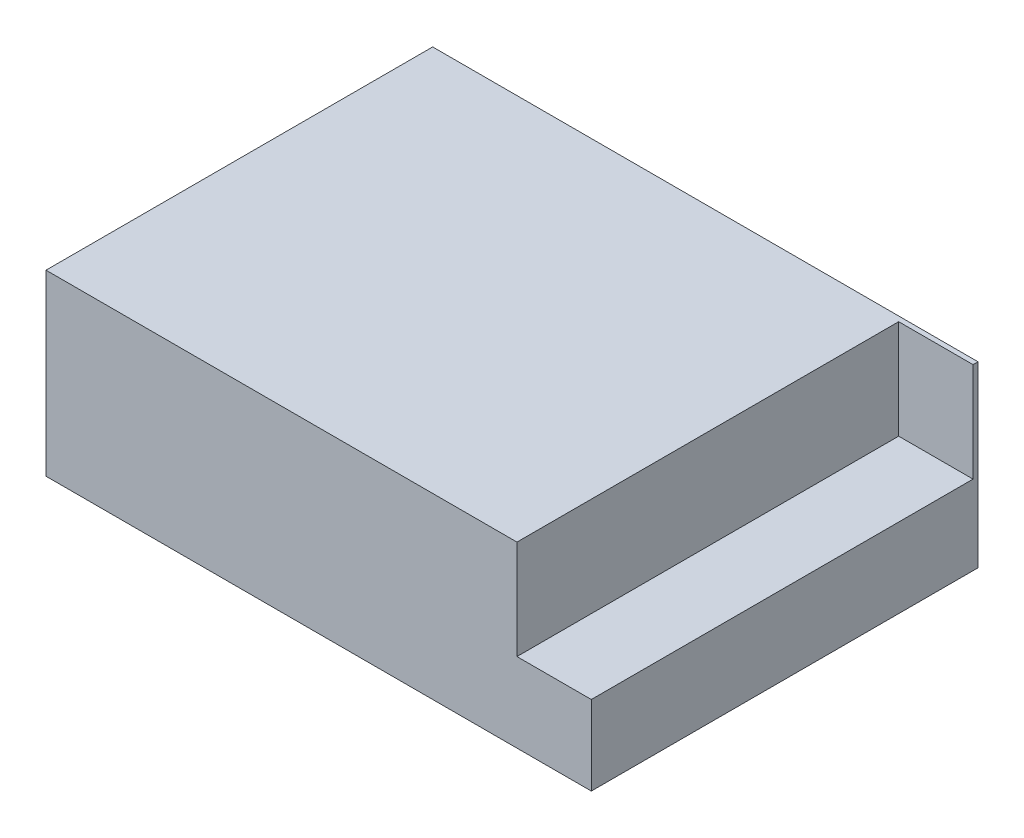
from build123d import *

# Parameters (mm, degrees)
SKETCH1_W           = 110
SKETCH1_H           = 78
BOSS_EXTRUDE1_DEPTH = 36
SKETCH2_W           = 15
SKETCH2_H           = 20
CUT_EXTRUDE1_DEPTH  = 77


with BuildPart() as part:
    # Sketch1 → Boss-Extrude1 (new body)
    with BuildSketch(Plane(origin=(0, 0, 0), x_dir=(1, 0, 0), z_dir=(0, 1, 0))):
        with Locations((55, 39)):
            Rectangle(SKETCH1_W, SKETCH1_H)
    extrude(amount=BOSS_EXTRUDE1_DEPTH)

    # Sketch2 → Cut-Extrude1 (cut)
    with BuildSketch(Plane.XY):
        with Locations((102.5, 26)):
            Rectangle(SKETCH2_W, SKETCH2_H)
    extrude(amount=-CUT_EXTRUDE1_DEPTH, mode=Mode.SUBTRACT)


solid = part.part
